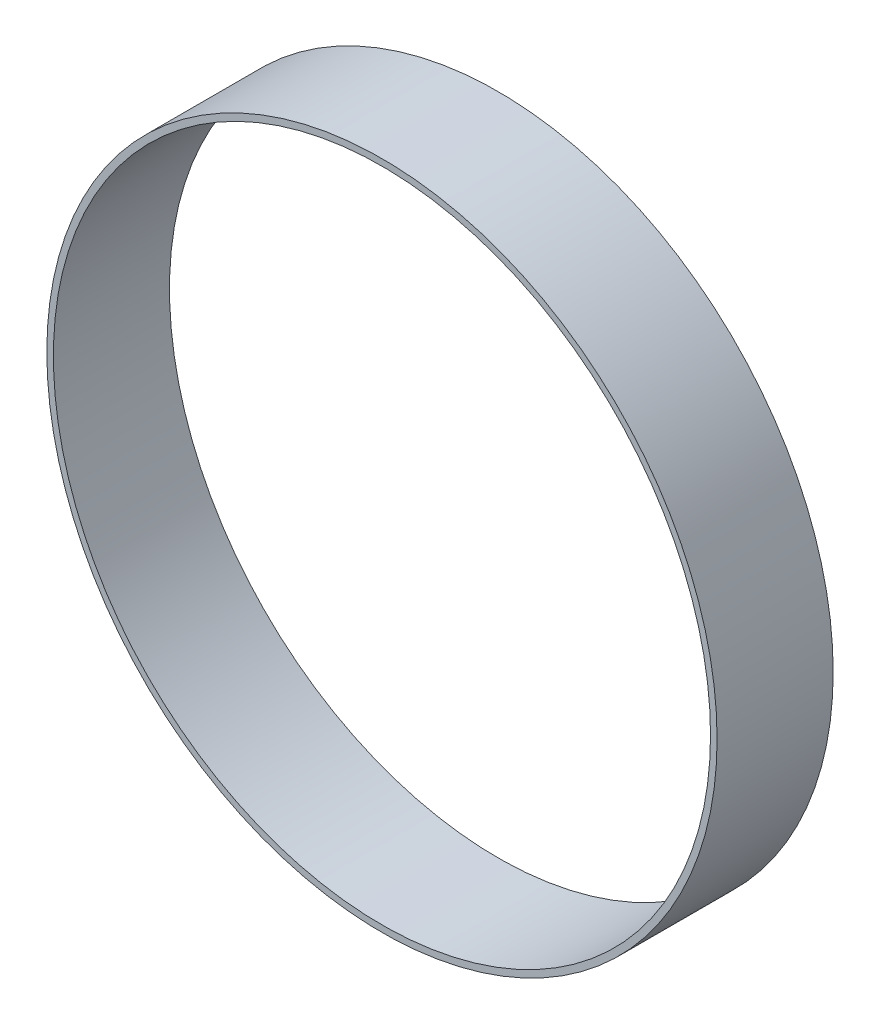
from build123d import *

# Parameters (mm, degrees)
EXTRUDE_THIN1_DEPTH = 53


with BuildPart() as part:
    # Sketch1 → Extrude-Thin1 (new body)
    with BuildSketch(Plane.XY):
        with BuildLine():
            ThreePointArc((-95.832468518, 119.26918285), (42.895315946, -146.863854879), (16.572259633, 152.099836327))
            ThreePointArc((16.572259633, 152.099836327), (-42.895315946, 146.863854879), (-95.832468518, 119.26918285))
        make_face()
        with BuildLine():
            ThreePointArc((-93.953400508, 116.930571422), (42.054231319, -143.98417145), (16.247313365, 149.117486595))
            ThreePointArc((16.247313365, 149.117486595), (-42.054231319, 143.98417145), (-93.953400508, 116.930571422))
        make_face(mode=Mode.SUBTRACT)
    extrude(amount=EXTRUDE_THIN1_DEPTH)


solid = part.part
